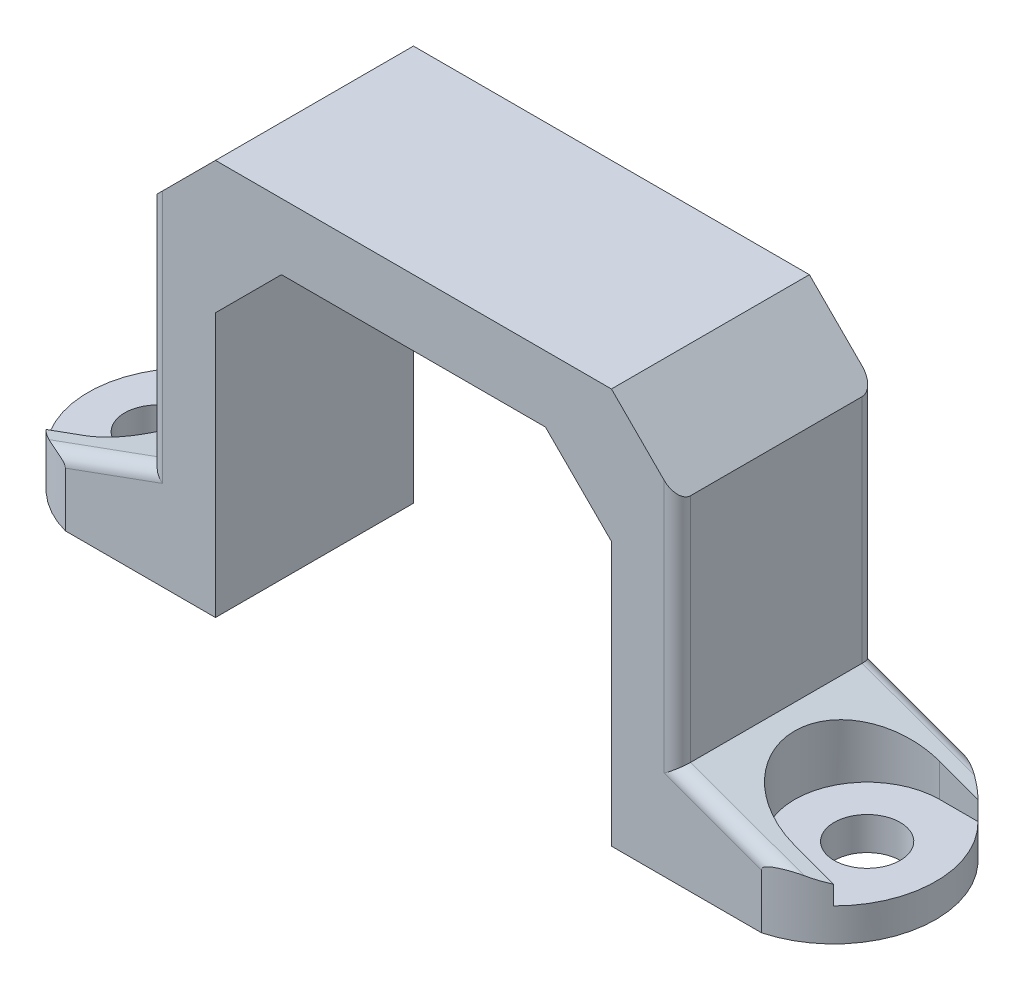
from build123d import *

# Parameters (mm, degrees)
AUFSATZ_LINEAR_AUSTRAGEN1_DEPTH = 6
SKIZZE4_R                       = 1
SCHNITT_LINEAR_AUSTRAGEN1_DEPTH = 3
SCHNITT_LINEAR_AUSTRAGEN2_DEPTH = 2
VERRUNDUNG1_R                   = 0.4
SCHNITT_LINEAR_AUSTRAGEN4_DEPTH = 3
AUFSATZ_LINEAR_AUSTRAGEN2_DEPTH = 0.75
SCHNITT_LINEAR_AUSTRAGEN5_DEPTH = 6


with BuildPart() as part:
    # Skizze1 → Aufsatz-Linear austragen1 (new body)
    with BuildSketch(Plane.XY):
        Polygon((0, 0), (7.5, 0), (7.5, 10), (19.5, 10), (19.5, 0), (27, 0), (27, 1), (21.5, 3), (21.5, 12), (5.5, 12), (5.5, 3), (0, 1), align=None)
    extrude(amount=AUFSATZ_LINEAR_AUSTRAGEN1_DEPTH)

    # Skizze4 → Schnitt-Linear austragen1 (cut)
    with BuildSketch(Plane.XZ):
        with Locations(Location((24.25, 3, 0), (0, 0, 270))):
            Circle(SKIZZE4_R)
    schnitt_linear_austragen1 = extrude(amount=-SCHNITT_LINEAR_AUSTRAGEN1_DEPTH, mode=Mode.SUBTRACT)

    # Skizze5 → Schnitt-Linear austragen2 (cut)
    with BuildSketch(Plane(origin=(0, 3, 0), x_dir=(-1, 0, 0), z_dir=(0, -1, 0))):
        with BuildLine():
            Line((-24.25, -5.2), (-27, -5.2))
            Line((-27, -5.2), (-27, -0.8))
            Line((-27, -0.8), (-24.25, -0.8))
            ThreePointArc((-24.25, -0.8), (-22.05, -3), (-24.25, -5.2))
        make_face()
    schnitt_linear_austragen2 = extrude(amount=SCHNITT_LINEAR_AUSTRAGEN2_DEPTH, mode=Mode.SUBTRACT)

    # Spiegeln1: Schnitt-Linear austragen1, Schnitt-Linear austragen2 across plane
    add(schnitt_linear_austragen1.mirror(Plane(origin=(13.5, 0, 0), x_dir=(0, 0, 1), z_dir=(1, 0, 0))), mode=Mode.SUBTRACT)
    add(schnitt_linear_austragen2.mirror(Plane(origin=(13.5, 0, 0), x_dir=(0, 0, 1), z_dir=(1, 0, 0))), mode=Mode.SUBTRACT)

    # Verrundung1
    verrundung1_edges = [part.edges().sort_by_distance(p)[0] for p in [
        (2.75, 2, 0),
        (5.5, 7.5, 0),
        (21.5, 7.5, 0),
        (24.25, 2, 0),
        (24.25, 2, 6),
        (21.5, 7.5, 6),
        (5.5, 7.5, 6),
        (2.75, 2, 6),
    ]]
    fillet(verrundung1_edges, radius=VERRUNDUNG1_R)

    # Skizze7 → Schnitt-Linear austragen4 (cut)
    with BuildSketch(Plane(origin=(0, 3, 0), x_dir=(-1, 0, 0), z_dir=(0, -1, 0))):
        with BuildLine():
            Line((-24.05, -6), (-27.346568129, -6))
            Line((-27.346568129, -6), (-27.346568129, 0))
            Line((-27.346568129, 0), (-23.943800363, 0))
            ThreePointArc((-23.943800363, 0), (-26.341645128, -2.958498156), (-24.05, -6))
        make_face()
    schnitt_linear_austragen4 = extrude(amount=SCHNITT_LINEAR_AUSTRAGEN4_DEPTH, mode=Mode.SUBTRACT)

    # Spiegeln2: Schnitt-Linear austragen4 across plane
    add(schnitt_linear_austragen4.mirror(Plane(origin=(13.5, 0, 0), x_dir=(0, 0, 1), z_dir=(1, 0, 0))), mode=Mode.SUBTRACT)

    # Skizze8 → Aufsatz-Linear austragen2 (add)
    with BuildSketch(Plane.XY.offset(6)):
        Polygon((9.5, 10), (7.5, 8), (7.5, 10), align=None)
        Polygon((17.5, 10), (19.5, 10), (19.5, 8), align=None)
    aufsatz_linear_austragen2 = extrude(amount=-AUFSATZ_LINEAR_AUSTRAGEN2_DEPTH)

    # Spiegeln3: Aufsatz-Linear austragen2 across plane
    add(aufsatz_linear_austragen2.mirror(Plane.XY.offset(3)))

    # Skizze9 → Schnitt-Linear austragen5 (cut)
    with BuildSketch(Plane.XY.offset(6)):
        Polygon((5.5, 12), (5.5, 10), (7.5, 12), align=None)
    schnitt_linear_austragen5 = extrude(amount=-SCHNITT_LINEAR_AUSTRAGEN5_DEPTH, mode=Mode.SUBTRACT)

    # Spiegeln4: Schnitt-Linear austragen5 across plane
    add(schnitt_linear_austragen5.mirror(Plane(origin=(13.5, 0, 0), x_dir=(0, 0, 1), z_dir=(1, 0, 0))), mode=Mode.SUBTRACT)


solid = part.part
